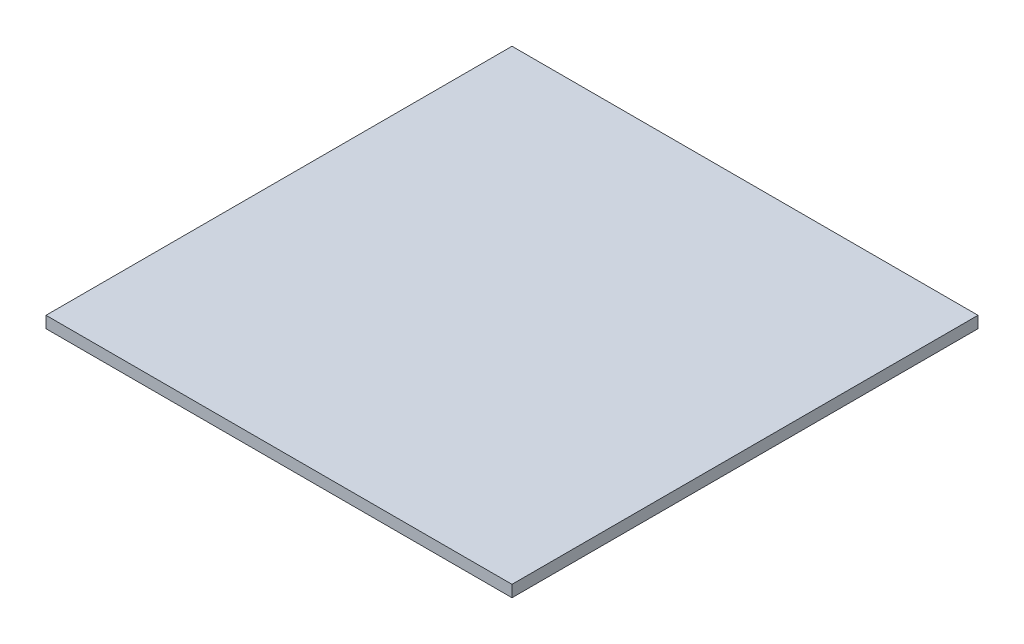
from build123d import *

# Parameters (mm, degrees)
SKETCH1_W           = 200
SKETCH1_H           = 200
BOSS_EXTRUDE1_DEPTH = 5


with BuildPart() as part:
    # Sketch1 → Boss-Extrude1 (new body)
    with BuildSketch(Plane(origin=(0, 0, 0), x_dir=(1, 0, 0), z_dir=(0, 1, 0))):
        with Locations((100, 100)):
            Rectangle(SKETCH1_W, SKETCH1_H)
    extrude(amount=BOSS_EXTRUDE1_DEPTH)


solid = part.part
